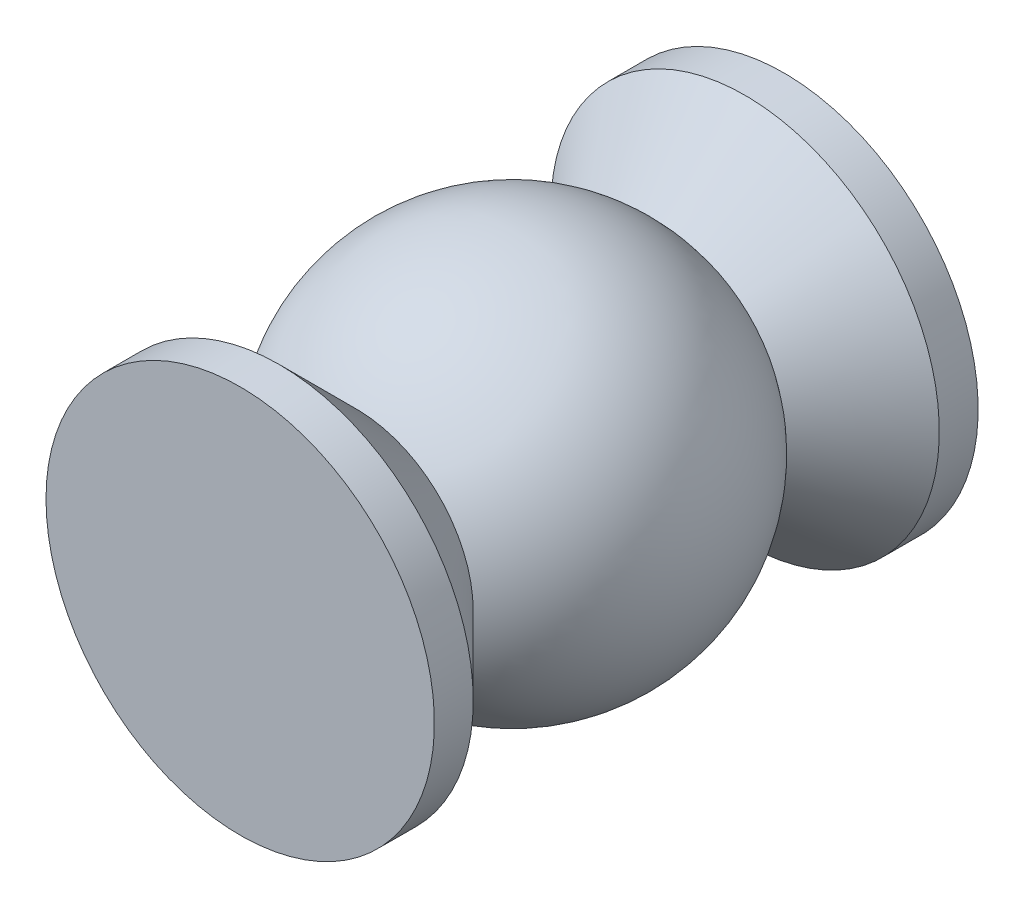
from build123d import *


with BuildPart() as part:
    # 草图2 → 旋转1 (revolve)
    with BuildSketch(Plane(origin=(0, 0, 0), x_dir=(1, 0, 0), z_dir=(0, 1, 0)), mode=Mode.PRIVATE) as revolve_1_sk:
        with BuildLine():
            Line((0, 35), (25, 35))
            Line((25, 35), (25, 30))
            Line((25, 30), (15, 20))
            ThreePointArc((15, 20), (25, 0), (15, -20))
            Line((15, -20), (25, -30))
            Line((25, -30), (25, -35))
            Line((25, -35), (0, -35))
            Line((0, -35), (0, 35))
        make_face()
    revolve(revolve_1_sk.sketch.rotate(Axis((0, 0, -35), (0, 0, 1)), 180), axis=Axis((0, 0, -35), (0, 0, 1)))


solid = part.part
